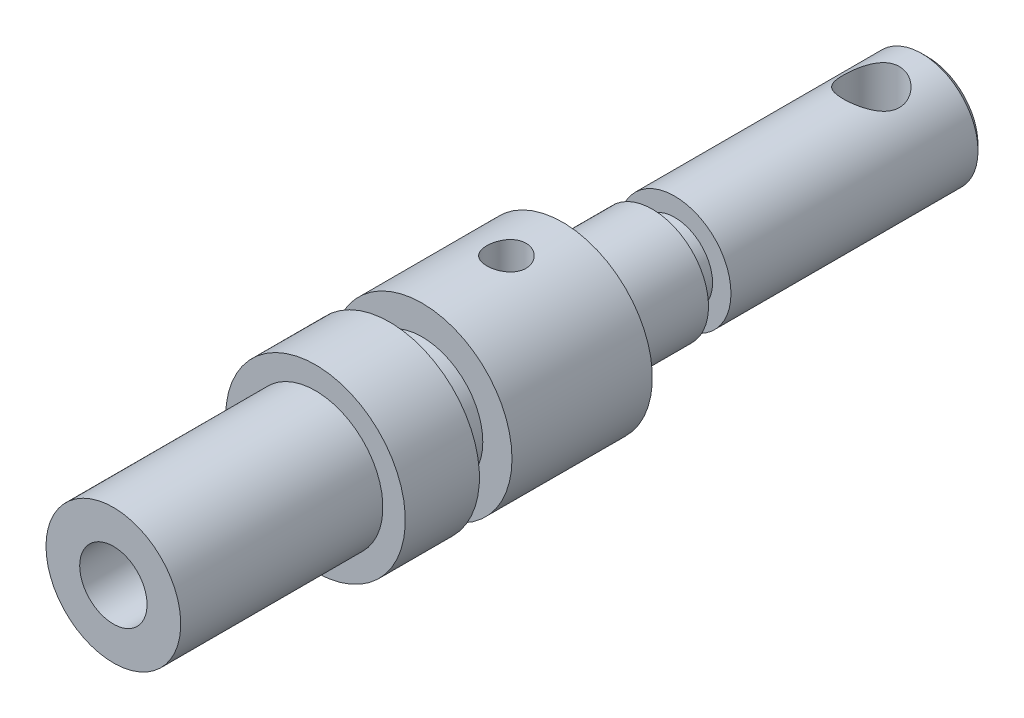
from build123d import *

# Parameters (mm, degrees)
ESQUISSE3_W             = 1.75
ESQUISSE3_H             = 18.21482984
CHANFREIN1_SIZE         = 0.5
ESQUISSE6_R             = 2.5
ENL_V_MAT_EXTRU_1_DEPTH = 7.5


with BuildPart() as part:
    # Esquisse2 → Base-Révolution (revolve)
    with BuildSketch(Plane(origin=(0, 0, 0), x_dir=(0, 0, -1), z_dir=(1, 0, 0))):
        Polygon((0, -3), (0, -6), (18, -6), (18, -8), (40, -8), (40, -5), (72.5, -5), (72.5, 0), (42.732050808, 0), (41, -3), align=None)
    revolve(axis=Axis((0, 0, 0), (0, 0, 1)))

    # Esquisse3 → Enlèvement de matière-Révolution1 (revolve, cut)
    with BuildSketch(Plane(origin=(0, 0, -35), x_dir=(-1, 0, 0), z_dir=(0, 0, -1))):
        with Locations((-0.875, 0.285598377)):
            Rectangle(ESQUISSE3_W, ESQUISSE3_H)
    revolve(axis=Axis((0, 0, -35), (0, -1, 0)), mode=Mode.SUBTRACT)

    # Chanfrein1
    chanfrein1_edges = [part.edges().sort_by_distance(p)[0] for p in [
        (0, 5, -72.5),
    ]]
    chamfer(chanfrein1_edges, length=CHANFREIN1_SIZE)

    # Esquisse6 → Enlèv. mat.-Extru.1 (cut, symmetric)
    with BuildSketch(Plane(origin=(0, 0, 0), x_dir=(1, 0, 0), z_dir=(0, 1, 0))):
        with Locations((0, 67.5)):
            Circle(ESQUISSE6_R)
    extrude(amount=ENL_V_MAT_EXTRU_1_DEPTH, both=True, mode=Mode.SUBTRACT)

    # Esquisse5 → Enlèvement de matière-Révolution3 (revolve, cut)
    with BuildSketch(Plane(origin=(0, 0, 0), x_dir=(0, 0, -1), z_dir=(1, 0, 0))):
        Polygon((24.6, 30), (24.6, 5.4), (27.5, 5.4), (27.5, 20), (48, 20), (48, 3.36), (50, 3.36), (50, 30), align=None)
    revolve(axis=Axis((0, 0, 18.428634536), (0, 0, -1)), mode=Mode.SUBTRACT)


solid = part.part
